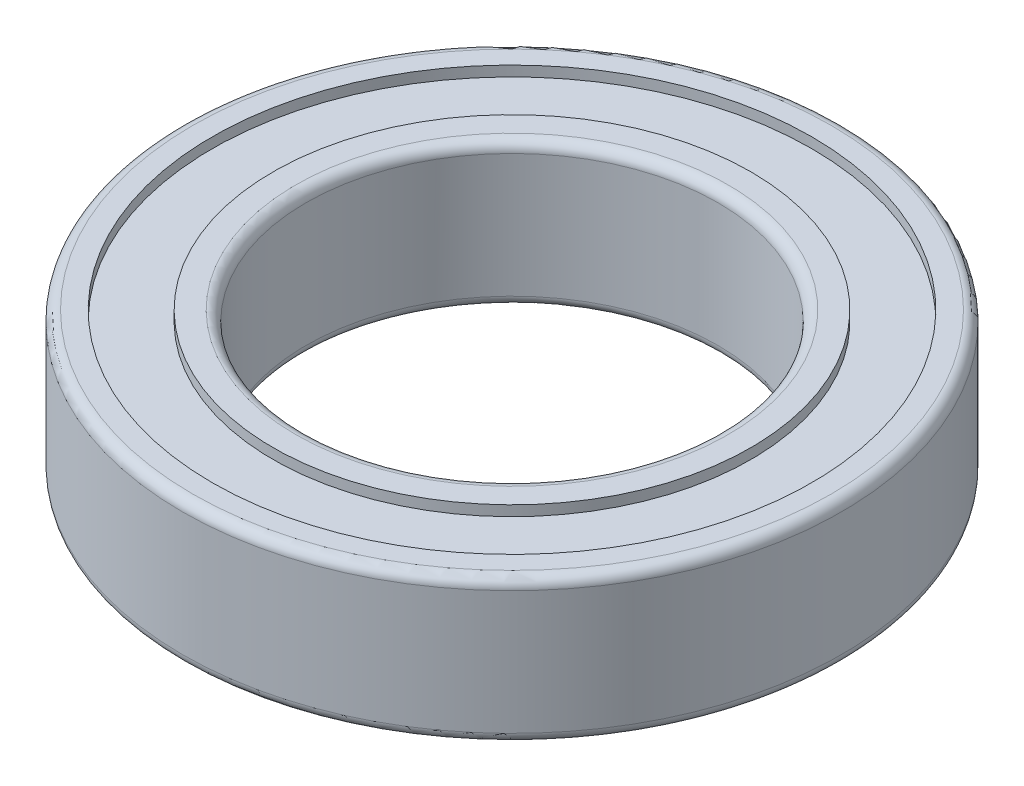
from build123d import *

# Parameters (mm, degrees)
VERRUNDUNG1_R = 0.5


with BuildPart() as part:
    # Skizze1 → Rotation1 (revolve)
    with BuildSketch(Plane.XY, mode=Mode.PRIVATE) as rotation1_sk:
        Polygon((10, 0), (11.6, 0), (11.6, 0.5), (14.55, 0.5), (14.55, 0), (16, 0), (16, 7), (14.55, 7), (14.55, 6.5), (11.6, 6.5), (11.6, 7), (10, 7), align=None)
    revolve(rotation1_sk.sketch.rotate(Axis((0, 0, 0), (0, 1, 0)), 90), axis=Axis((0, 0, 0), (0, 1, 0)))

    # Verrundung1
    verrundung1_edges = [part.edges().sort_by_distance(p)[0] for p in [
        (0, 7, 16),
        (0, 0, 16),
        (0, 0, 10),
        (0, 7, 10),
    ]]
    fillet(verrundung1_edges, radius=VERRUNDUNG1_R)


solid = part.part
